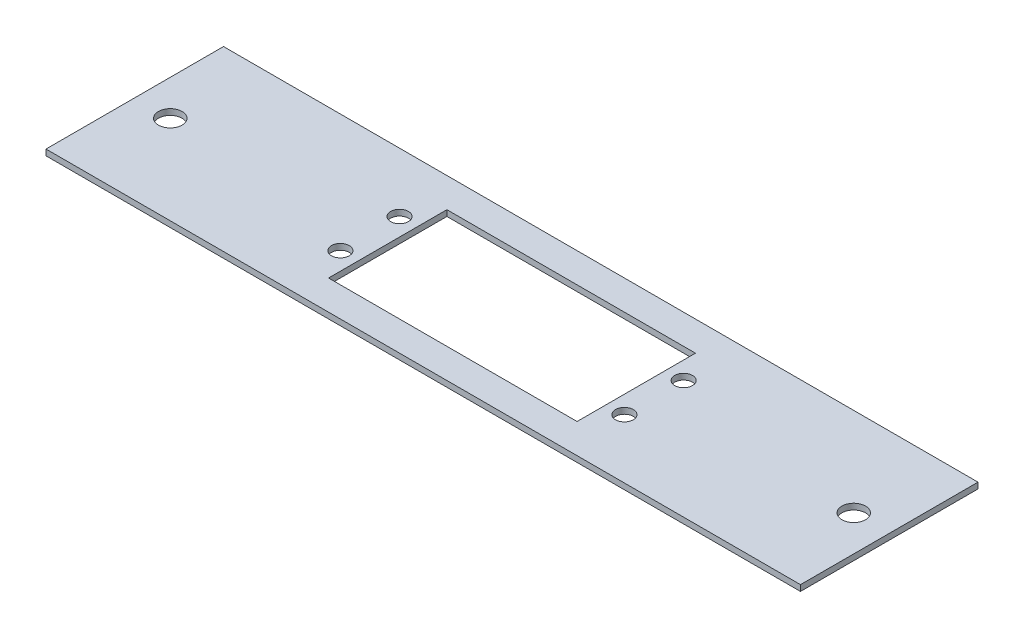
from build123d import *

# Parameters (mm, degrees)
SKETCH1_W           = 127.5
SKETCH1_H           = 30
SKETCH1_R           = 2
SKETCH1_W_2         = 42
SKETCH1_H_2         = 20
BOSS_EXTRUDE1_DEPTH = 1
SKETCH2_R           = 1.5
CUT_EXTRUDE1_DEPTH  = 66.498568687


with BuildPart() as part:
    # Sketch1 → Boss-Extrude1 (new body)
    with BuildSketch(Plane(origin=(0, 0, 0), x_dir=(1, 0, 0), z_dir=(0, 1, 0))):
        Rectangle(SKETCH1_W, SKETCH1_H)
        with Locations(Location((-57.75, 0, 0), (0, 0, 270))):
            Circle(SKETCH1_R, mode=Mode.SUBTRACT)
        with Locations(Location((57.75, 0, 0), (0, 0, 90))):
            Circle(SKETCH1_R, mode=Mode.SUBTRACT)
        Rectangle(SKETCH1_W_2, SKETCH1_H_2, mode=Mode.SUBTRACT)
    extrude(amount=BOSS_EXTRUDE1_DEPTH)

    # Sketch2 → Cut-Extrude1 (cut, through all)
    with BuildSketch(Plane(origin=(0, 1, 0), x_dir=(1, 0, 0), z_dir=(0, 1, 0))):
        with Locations(Location((-24, 5, 0), (0, 0, 270))):
            Circle(SKETCH2_R)
        with Locations(Location((-24, -5, 0), (0, 0, 90))):
            Circle(SKETCH2_R)
        with Locations(Location((24, -5, 0), (0, 0, 270))):
            Circle(SKETCH2_R)
        with Locations(Location((24, 5, 0), (0, 0, 90))):
            Circle(SKETCH2_R)
    extrude(amount=-CUT_EXTRUDE1_DEPTH, mode=Mode.SUBTRACT)


solid = part.part
